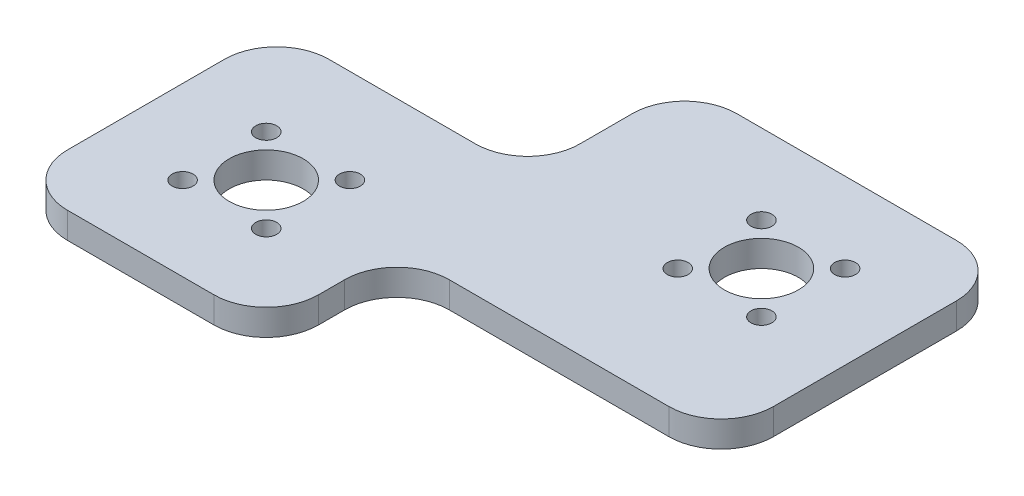
from build123d import *

# Parameters (mm, degrees)
BOSS_EXTRUDE1_DEPTH = 5
SKETCH2_R           = 7.075
SKETCH2_R_2         = 2
CUT_EXTRUDE1_DEPTH  = 5
FILLET1_R           = 10
FILLET2_R           = 10


with BuildPart() as part:
    # Sketch1 → Boss-Extrude1 (new body)
    with BuildSketch(Plane(origin=(0, 0, 0), x_dir=(1, 0, 0), z_dir=(0, 1, 0))):
        Polygon((-40.926174497, 16.946308725), (-88.926174497, 16.946308725), (-88.926174497, -33.053691275), (-40.926174497, -33.053691275), (-40.926174497, -8.053691275), (-30.926174497, -8.053691275), (-13.571066073, -8.053691275), (21.073825503, -8.053691275), (21.073825503, 46.946308725), (-30.926174497, 46.946308725), (-40.926174497, 46.946308725), align=None)
    extrude(amount=BOSS_EXTRUDE1_DEPTH)

    # Sketch2 → Cut-Extrude1 (cut)
    with BuildSketch(Plane(origin=(0, 5, 0), x_dir=(1, 0, 0), z_dir=(0, 1, 0))):
        with Locations(Location((-64.926174497, -9.053691275, 0), (0, 0, 270))):
            Circle(SKETCH2_R)
        with Locations(Location((-72.926174497, -1.053691275, 0), (0, 0, 270))):
            Circle(SKETCH2_R_2)
        with Locations(Location((-56.926174497, -1.053691275, 0), (0, 0, 270))):
            Circle(SKETCH2_R_2)
        with Locations(Location((-56.926174497, -17.053691275, 0), (0, 0, 270))):
            Circle(SKETCH2_R_2)
        with Locations(Location((-72.926174497, -17.053691275, 0), (0, 0, 270))):
            Circle(SKETCH2_R_2)
        with Locations(Location((-2.926174497, 23.643183553, 0), (0, 0, 270))):
            Circle(SKETCH2_R)
        with Locations(Location((5.073825503, 31.643183553, 0), (0, 0, 270))):
            Circle(SKETCH2_R_2)
        with Locations(Location((-10.926174497, 15.643183553, 0), (0, 0, 270))):
            Circle(SKETCH2_R_2)
        with Locations(Location((-10.926174497, 31.643183553, 0), (0, 0, 270))):
            Circle(SKETCH2_R_2)
        with Locations(Location((5.073825503, 15.643183553, 0), (0, 0, 270))):
            Circle(SKETCH2_R_2)
    extrude(amount=-CUT_EXTRUDE1_DEPTH, mode=Mode.SUBTRACT)

    # Fillet1
    fillet1_edges = [part.edges().sort_by_distance(p)[0] for p in [
        (-88.926174497, 2.5, -16.946308725),
    ]]
    fillet(fillet1_edges, radius=FILLET1_R)

    # Fillet2
    fillet2_edges = [part.edges().sort_by_distance(p)[0] for p in [
        (21.073825503, 2.5, -46.946308725),
        (21.073825503, 2.5, 8.053691275),
        (-40.926174497, 2.5, 8.053691275),
        (-40.926174497, 2.5, 33.053691275),
        (-88.926174497, 2.5, 33.053691275),
        (-40.926174497, 2.5, -16.946308725),
        (-40.926174497, 2.5, -46.946308725),
    ]]
    fillet(fillet2_edges, radius=FILLET2_R)


solid = part.part
